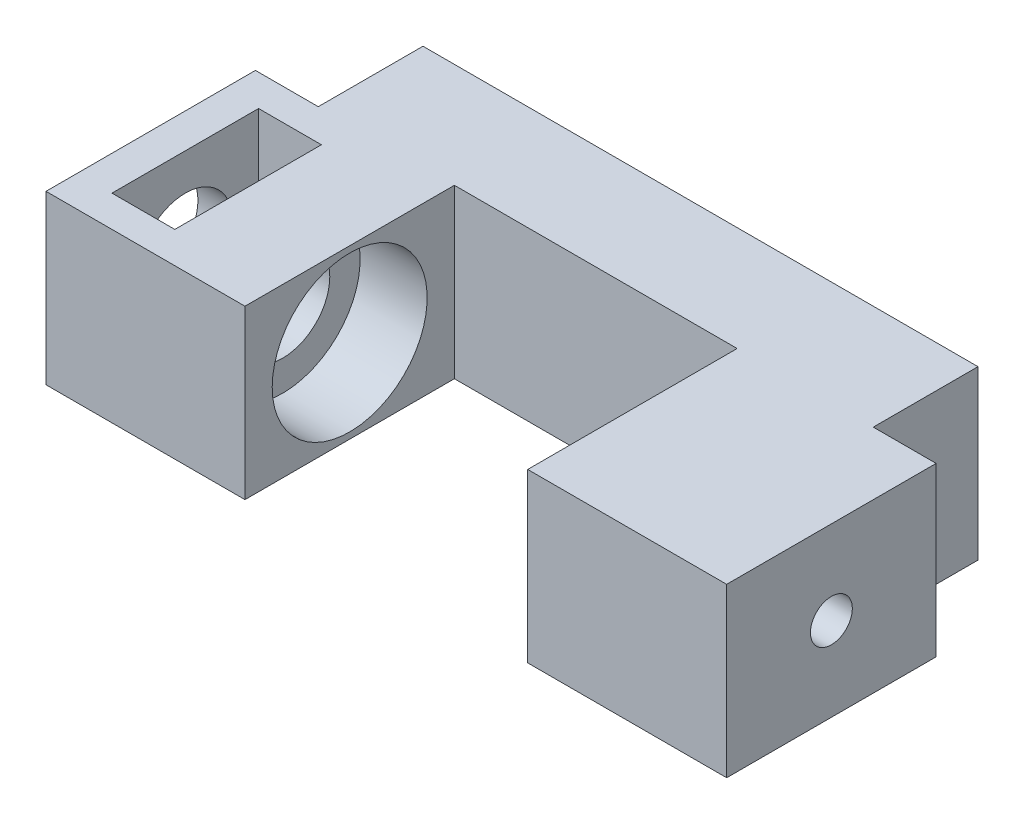
from build123d import *

# Parameters (mm, degrees)
SHAPE_DEPTH                   = 4
SHAPE_DEPTH_BACK              = 4
ESQUISSE19_R                  = 2.25
HOLEAXE_MOTOR_DEPTH           = 13
ESQUISSE20_R                  = 3.7
HOLEBEARING_MOTOR_DEPTH       = 3.2
ESQUISSE21_R                  = 2.2
ENTRETOISEBEARING_MOTOR_DEPTH = 1
EXT_MOTOR_START               = 3
ESQUISSE22_W                  = 10
ESQUISSE22_H                  = 8
ESQUISSE22_R                  = 2.25
EXT_MOTOR_DEPTH               = 3
ESQUISSE23_W                  = 3
ESQUISSE23_H                  = 7
HOLESCREWLESS_MOTOR_DEPTH     = 10
ESQUISSE24_W                  = 10
ESQUISSE24_H                  = 8
BOSS_EXTRU_1_DEPTH            = 3
ESQUISSE25_R                  = 1
REMOVE_HELPER_DEPTH           = 10


with BuildPart() as part:
    # Esquisse17 → Shape (new, two sides: drawn at the far end of the back side and taken through both)
    with BuildSketch(Plane(origin=(0, 40, 0), x_dir=(-1, 0, 0), z_dir=(0, -1, 0)).offset(-SHAPE_DEPTH_BACK)):
        Polygon((13.25, 105), (13.25, 95), (6.75, 95), (6.75, 105), (-6.75, 105), (-6.75, 95), (-13.25, 95), (-13.25, 105), (-13.25, 110), (13.25, 110), align=None)
    extrude(amount=SHAPE_DEPTH + SHAPE_DEPTH_BACK)

    # Esquisse19 → HoleAxe_motor (cut)
    with BuildSketch(Plane.ZY.offset(13.25)):
        with Locations((-100, 40)):
            Circle(ESQUISSE19_R)
    extrude(amount=-HOLEAXE_MOTOR_DEPTH, mode=Mode.SUBTRACT)

    # Esquisse20 → HoleBearing_motor (cut)
    with BuildSketch(Plane.ZY.offset(-6.75)):
        with Locations((-100, 40)):
            Circle(ESQUISSE20_R)
    holebearing_motor = extrude(amount=-HOLEBEARING_MOTOR_DEPTH, mode=Mode.SUBTRACT)

    # Symétrie3: HoleBearing_motor across plane
    add(holebearing_motor.mirror(Plane(origin=(0, 0, 0), x_dir=(0, 0, 1), z_dir=(1, 0, 0))), mode=Mode.SUBTRACT)

    # Esquisse21 → entretoiseBearing_motor (cut)
    with BuildSketch(Plane.ZY.offset(-9.95)):
        with Locations((-100, 40)):
            Circle(ESQUISSE21_R)
    extrude(amount=-ENTRETOISEBEARING_MOTOR_DEPTH, mode=Mode.SUBTRACT)

    # Esquisse22 → Ext_motor (add)
    with BuildSketch(Plane.ZY.offset(13.25).offset(EXT_MOTOR_START)):
        with Locations((-100, 40)):
            Rectangle(ESQUISSE22_W, ESQUISSE22_H)
        with Locations((-100, 40)):
            Circle(ESQUISSE22_R, mode=Mode.SUBTRACT)
    extrude(amount=-EXT_MOTOR_DEPTH)

    # Esquisse23 → HoleScrewLess_motor (cut)
    with BuildSketch(Plane(origin=(0, 44, 0), x_dir=(1, 0, 0), z_dir=(0, 1, 0))):
        with Locations((-13.1, 100)):
            Rectangle(ESQUISSE23_W, ESQUISSE23_H)
    extrude(amount=-HOLESCREWLESS_MOTOR_DEPTH, mode=Mode.SUBTRACT)

    # Esquisse24 → Boss.-Extru.1 (add)
    with BuildSketch(Plane(origin=(13.25, 0, 0), x_dir=(0, 0, -1), z_dir=(1, 0, 0))):
        with Locations((100, 40)):
            Rectangle(ESQUISSE24_W, ESQUISSE24_H)
    extrude(amount=BOSS_EXTRU_1_DEPTH)

    # Esquisse25 → Remove helper (cut)
    with BuildSketch(Plane.ZY.offset(-10.95)):
        with Locations((-100, 40)):
            Circle(ESQUISSE25_R)
    extrude(amount=-REMOVE_HELPER_DEPTH, mode=Mode.SUBTRACT)


solid = part.part
